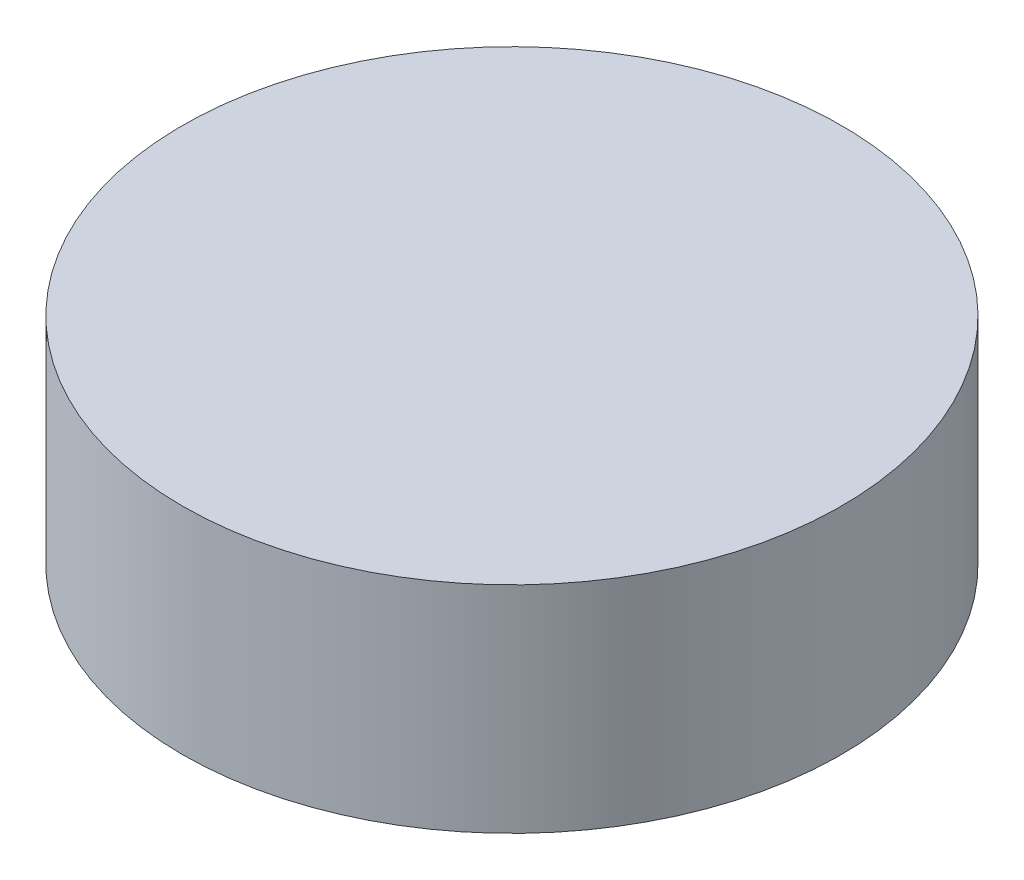
from build123d import *

# Parameters (mm, degrees)
SKETCH_1_R      = 2.45
EXTRUDE_1_DEPTH = 1.6


with BuildPart() as part:
    # 草图1 → 凸台-拉伸1 (new body)
    with BuildSketch(Plane(origin=(0, 0, 0), x_dir=(1, 0, 0), z_dir=(0, 1, 0))):
        with Locations(Location((0, 0, 0), (0, 0, 270))):
            Circle(SKETCH_1_R)
    extrude(amount=EXTRUDE_1_DEPTH)


solid = part.part
